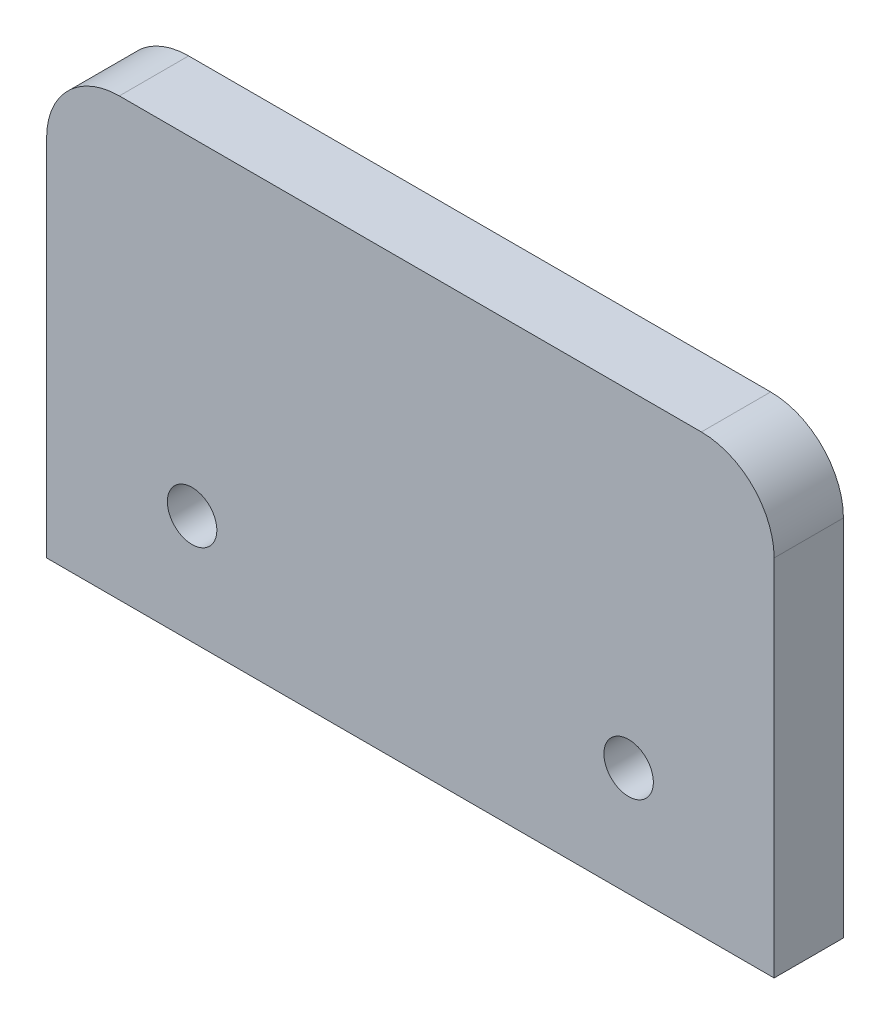
from build123d import *

# Parameters (mm, degrees)
ESBO_O1_W                 = 100
ESBO_O1_H                 = 60
RESSALTO_EXTRUS_O1_DEPTH  = 9.525
FILETE1_R                 = 10
FURO_ROSCADO_DE_M61_D     = 5
FURO_ROSCADO_DE_M61_DEPTH = 15
FURO_ROSCADO_DE_M61_TIP   = 1.502151548
ESBO_O5_R                 = 3
CORTE_EXTRUS_O1_DEPTH     = 60.082363062
FURO_ROSCADO_DE_M82_D     = 6.8


with BuildPart() as part:
    # Esboço1 → Ressalto-extrusão1 (new body)
    with BuildSketch(Plane.XY):
        Rectangle(ESBO_O1_W, ESBO_O1_H)
    extrude(amount=RESSALTO_EXTRUS_O1_DEPTH)

    # Filete1
    filete1_edges = [part.edges().sort_by_distance(p)[0] for p in [
        (-50, 30, 4.7625),
        (50, 30, 4.7625),
    ]]
    fillet(filete1_edges, radius=FILETE1_R)

    # Furo roscado de M61
    with Locations(Plane(origin=(0, -30, 0), x_dir=(-1, 0, 0), z_dir=(0, -1, 0))):
        with Locations((20, -4.7625), (-20, -4.7625)):
            Hole(FURO_ROSCADO_DE_M61_D / 2, depth=FURO_ROSCADO_DE_M61_DEPTH)
            with Locations((0, 0, -(FURO_ROSCADO_DE_M61_DEPTH + FURO_ROSCADO_DE_M61_TIP / 2))):  # 118° drill point
                Cone(0, FURO_ROSCADO_DE_M61_D / 2, FURO_ROSCADO_DE_M61_TIP, mode=Mode.SUBTRACT)

    # Esboço5 → Corte-extrusão1 (cut, through all)
    with BuildSketch(Plane.XY.offset(9.525)):
        with Locations((30, -15)):
            Circle(ESBO_O5_R)
        with Locations((-30, -15)):
            Circle(ESBO_O5_R)
    extrude(amount=-CORTE_EXTRUS_O1_DEPTH, mode=Mode.SUBTRACT)

    # Furo roscado de M82 (through all)
    with Locations(Plane(origin=(30, -15, 0), x_dir=(-1, 0, 0), z_dir=(0, 0, -1))):
        with Locations((0, 0), (60, 0)):
            Hole(FURO_ROSCADO_DE_M82_D / 2)


solid = part.part
